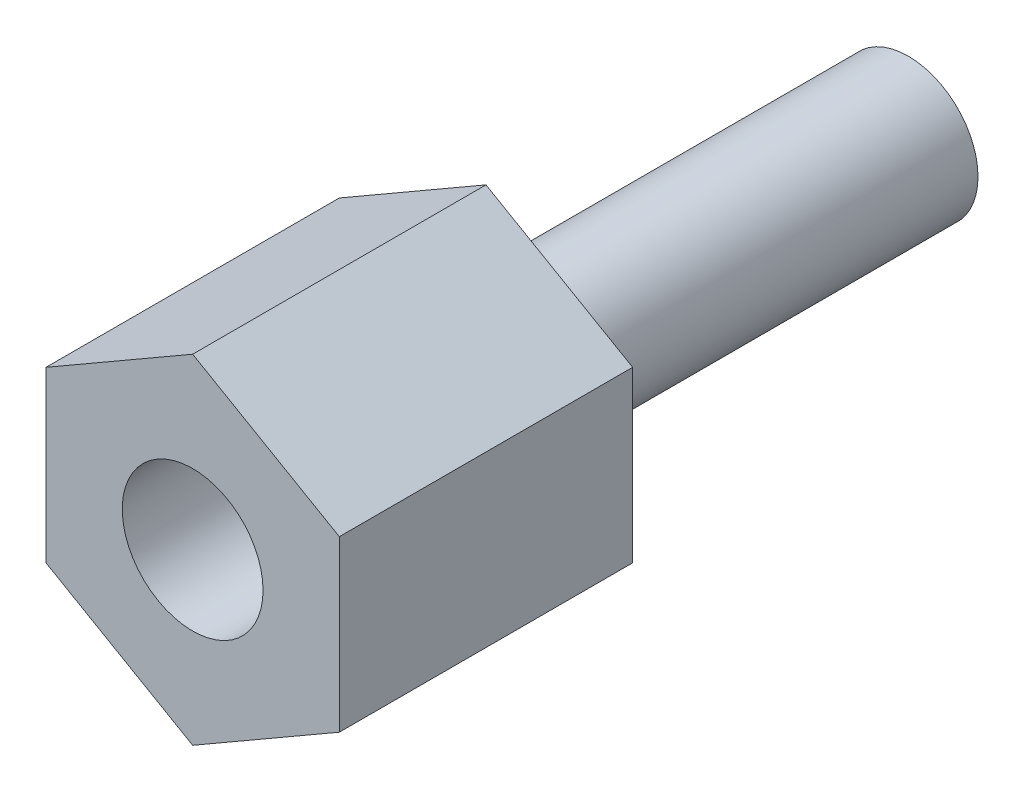
from build123d import *

# Parameters (mm, degrees)
BOSS_EXTRUDE1_DEPTH = 4.7625
SKETCH2_R           = 1.1303
BOSS_EXTRUDE2_DEPTH = 6.858
SKETCH3_R           = 1.143
CUT_EXTRUDE1_DEPTH  = 2.54


with BuildPart() as part:
    # Sketch1 → Boss-Extrude1 (new body)
    with BuildSketch(Plane.XY):
        Polygon((0, 2.749630657), (-2.38125, 1.374815329), (-2.38125, -1.374815329), (0, -2.749630657), (2.38125, -1.374815329), (2.38125, 1.374815329), align=None)
    extrude(amount=BOSS_EXTRUDE1_DEPTH)

    # Sketch2 → Boss-Extrude2 (add)
    with BuildSketch(Plane(origin=(0, 0, 0), x_dir=(-1, 0, 0), z_dir=(0, 0, -1))):
        with Locations(Location((0, 0, 0), (0, 0, 180))):
            Circle(SKETCH2_R)
    extrude(amount=BOSS_EXTRUDE2_DEPTH)

    # Sketch3 → Cut-Extrude1 (cut)
    with BuildSketch(Plane.XY.offset(4.7625)):
        Circle(SKETCH3_R)
    extrude(amount=-CUT_EXTRUDE1_DEPTH, mode=Mode.SUBTRACT)


solid = part.part
